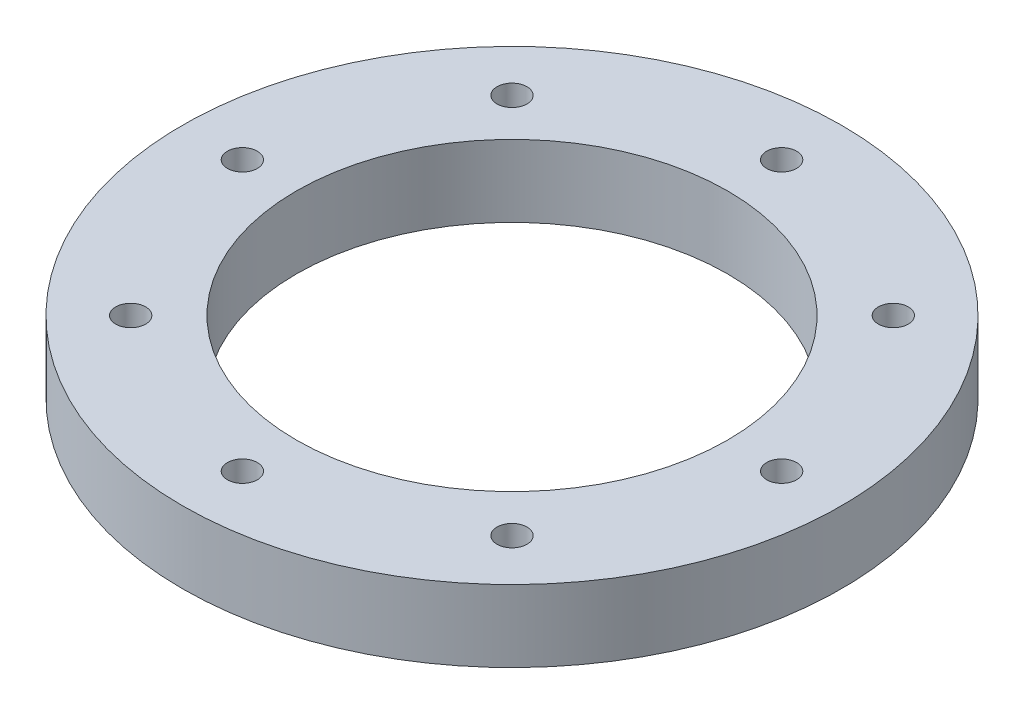
from build123d import *

# Parameters (mm, degrees)
SKETCH1_R           = 55
SKETCH1_R_2         = 36
BOSS_EXTRUDE1_DEPTH = 12
SKETCH2_R           = 1.7
CUT_EXTRUDE1_DEPTH  = 79.70196948
SKETCH3_R           = 2.5
CUT_EXTRUDE2_DEPTH  = 5
CIRPATTERN1_COUNT   = 8


with BuildPart() as part:
    # Sketch1 → Boss-Extrude1 (new body)
    with BuildSketch(Plane(origin=(0, 0, 0), x_dir=(1, 0, 0), z_dir=(0, 1, 0))):
        with Locations(Location((0, 0, 0), (0, 0, 270))):
            Circle(SKETCH1_R)
        with Locations(Location((0, 0, 0), (0, 0, 270))):
            Circle(SKETCH1_R_2, mode=Mode.SUBTRACT)
    extrude(amount=BOSS_EXTRUDE1_DEPTH)

    # Sketch2 → Cut-Extrude1 (cut, symmetric)
    with BuildSketch(Plane(origin=(0, 12, 0), x_dir=(1, 0, 0), z_dir=(0, 1, 0))):
        with Locations(Location((45, 0, 0), (0, 0, 270))):
            Circle(SKETCH2_R)
    cut_extrude1 = extrude(amount=CUT_EXTRUDE1_DEPTH, both=True, mode=Mode.SUBTRACT)

    # Sketch3 → Cut-Extrude2 (cut)
    with BuildSketch(Plane(origin=(0, 12, 0), x_dir=(1, 0, 0), z_dir=(0, 1, 0))):
        with Locations(Location((45, 0, 0), (0, 0, 270))):
            Circle(SKETCH3_R)
    cut_extrude2 = extrude(amount=-CUT_EXTRUDE2_DEPTH, mode=Mode.SUBTRACT)

    # CirPattern1: Cut-Extrude1, Cut-Extrude2 ×8 about axis
    cirpattern1_axis = Axis((0, 0, 0), (0, 1, 0))
    add([cut_extrude1.rotate(cirpattern1_axis, i * 360 / CIRPATTERN1_COUNT) for i in range(1, CIRPATTERN1_COUNT)], mode=Mode.SUBTRACT)
    add([cut_extrude2.rotate(cirpattern1_axis, i * 360 / CIRPATTERN1_COUNT) for i in range(1, CIRPATTERN1_COUNT)], mode=Mode.SUBTRACT)


solid = part.part
